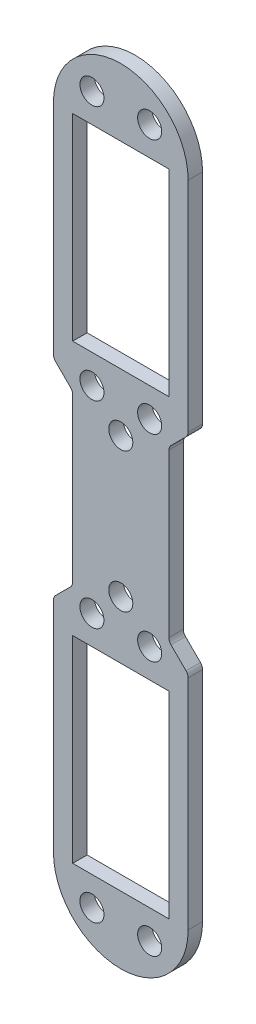
from build123d import *

# Parameters (mm, degrees)
SKETCH1_W           = 2
SKETCH1_H           = 4.09895497
SKETCH1_H_2         = 4.100689225
BOSS_EXTRUDE1_DEPTH = 0.3
SKETCH2_R           = 0.25
CUT_EXTRUDE2_DEPTH  = 0.3
FILLET10_R          = 0.15


with BuildPart() as part:
    # Sketch1 → Boss-Extrude1 (new body)
    with BuildSketch(Plane.XY):
        with BuildLine():
            Line((0, 0), (0, 4.600689225))
            Line((0, 4.600689225), (0.4, 5))
            Line((0.4, 5), (0.4, 8.5))
            Line((0.4, 8.5), (0, 8.90104503))
            Line((0, 8.90104503), (0, 13.5))
            ThreePointArc((0, 13.5), (1.4, 14.9), (2.8, 13.5))
            Line((2.8, 13.5), (2.8, 8.900318658))
            Line((2.8, 8.900318658), (2.4, 8.5))
            Line((2.4, 8.5), (2.4, 5))
            Line((2.4, 5), (2.8, 4.60077765))
            Line((2.8, 4.60077765), (2.8, 0))
            ThreePointArc((2.8, 0), (1.4, -1.4), (0, 0))
        make_face()
        with Locations((1.4, 11.450522515)):
            Rectangle(SKETCH1_W, SKETCH1_H, mode=Mode.SUBTRACT)
        with Locations((1.4, 2.050344612)):
            Rectangle(SKETCH1_W, SKETCH1_H_2, mode=Mode.SUBTRACT)
    extrude(amount=BOSS_EXTRUDE1_DEPTH)

    # Sketch2 → Cut-Extrude2 (cut)
    with BuildSketch(Plane.XY.offset(0.3)):
        with Locations((1.4, 8.199310775)):
            Circle(SKETCH2_R)
        with Locations((2, 14.1)):
            Circle(SKETCH2_R)
        with Locations((1.4, 5.300689225)):
            Circle(SKETCH2_R)
        with Locations((0.8, 14.1)):
            Circle(SKETCH2_R)
        with BuildLine():
            ThreePointArc((1.807854557, -0.440062109), (2.176776695, -0.776776695), (1.840062109, -0.407854557))
            ThreePointArc((1.840062109, -0.407854557), (1.824264069, -0.424264069), (1.807854557, -0.440062109))
        make_face()
        with BuildLine():
            ThreePointArc((0.992145443, -0.440062109), (0.975735931, -0.424264069), (0.959937891, -0.407854557))
            ThreePointArc((0.959937891, -0.407854557), (0.623223305, -0.776776695), (0.992145443, -0.440062109))
        make_face()
        with Locations((0.8, 4.700689225)):
            Circle(SKETCH2_R)
        with Locations((2, 4.700689225)):
            Circle(SKETCH2_R)
        with Locations((2, 8.799310775)):
            Circle(SKETCH2_R)
        with Locations((0.8, 8.799310775)):
            Circle(SKETCH2_R)
    extrude(amount=-CUT_EXTRUDE2_DEPTH, mode=Mode.SUBTRACT)

    # Fillet10
    fillet10_edges = [part.edges().sort_by_distance(p)[0] for p in [
        (0, 4.600689225, 0.15),
        (0.4, 5, 0.15),
        (0.4, 8.5, 0.15),
        (0, 8.90104503, 0.15),
        (2.8, 8.900318658, 0.15),
        (2.4, 8.5, 0.15),
        (2.4, 5, 0.15),
        (2.8, 4.60077765, 0.15),
    ]]
    fillet(fillet10_edges, radius=FILLET10_R)


solid = part.part
